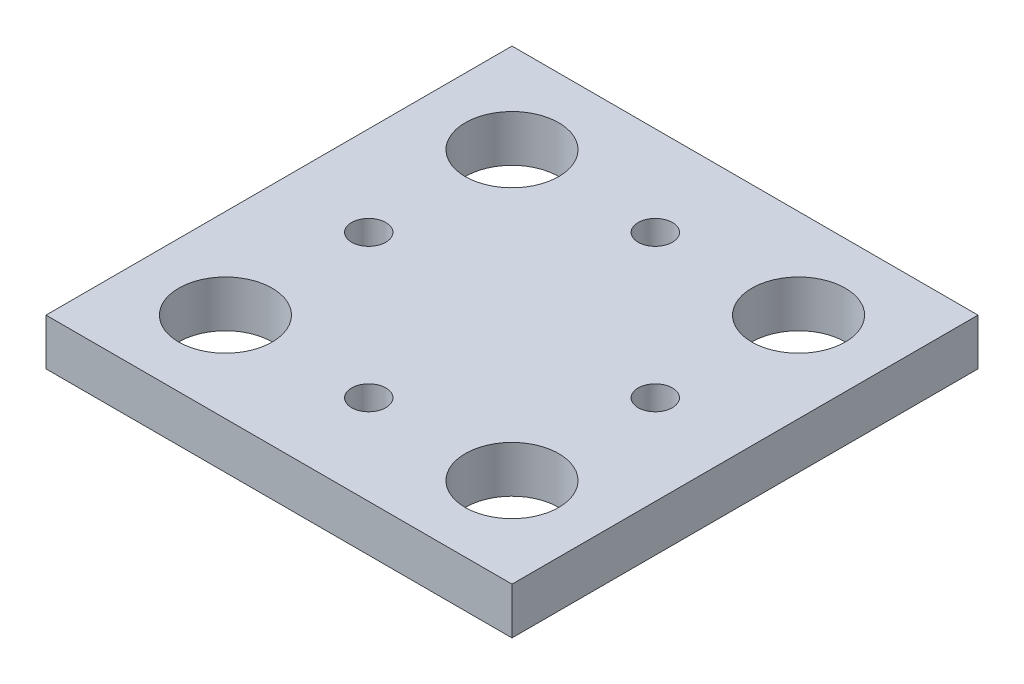
from build123d import *

# Parameters (mm, degrees)
SKETCH1_W               = 100
SKETCH1_H               = 100
BOSS_EXTRUDE1_DEPTH     = 10
CUT_EXTRUDE3_DEPTH      = 72.414284285
CUT_EXTRUDE3_DEPTH_BACK = 72.414284285
SKETCH3_R               = 10.025
SKETCH3_R_2             = 3.675


with BuildPart() as part:
    # Sketch1 → Boss-Extrude1 (new body)
    with BuildSketch(Plane(origin=(0, 0, 0), x_dir=(1, 0, 0), z_dir=(0, 1, 0))):
        Rectangle(SKETCH1_W, SKETCH1_H)
    extrude(amount=BOSS_EXTRUDE1_DEPTH)

    # Sketch3 → Cut-Extrude3 (cut, two sides: drawn at the far end of the back side and taken through both)
    with BuildSketch(Plane(origin=(0, 0, 0), x_dir=(1, 0, 0), z_dir=(0, 1, 0)).offset(-CUT_EXTRUDE3_DEPTH_BACK)):
        with Locations(Location((-30.7468, 30.7468, 0), (0, 0, 270))):
            Circle(SKETCH3_R)
        with Locations(Location((30.7468, 30.7468, 0), (0, 0, 270))):
            Circle(SKETCH3_R)
        with Locations(Location((30.7468, -30.7468, 0), (0, 0, 270))):
            Circle(SKETCH3_R)
        with Locations(Location((-30.7468, -30.7468, 0), (0, 0, 270))):
            Circle(SKETCH3_R)
        with Locations(Location((0, 30.7468, 0), (0, 0, 270))):
            Circle(SKETCH3_R_2)
        with Locations(Location((30.7468, 0, 0), (0, 0, 270))):
            Circle(SKETCH3_R_2)
        with Locations(Location((0, -30.7468, 0), (0, 0, 270))):
            Circle(SKETCH3_R_2)
        with Locations(Location((-30.7468, 0, 0), (0, 0, 270))):
            Circle(SKETCH3_R_2)
    extrude(amount=CUT_EXTRUDE3_DEPTH + CUT_EXTRUDE3_DEPTH_BACK, mode=Mode.SUBTRACT)


solid = part.part
